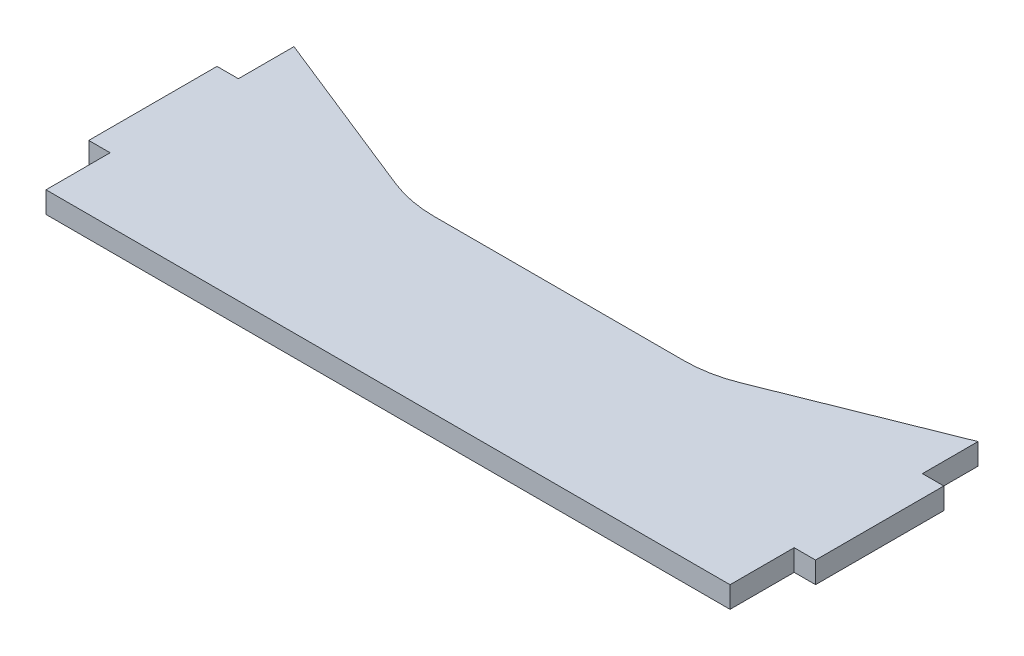
from build123d import *

# Parameters (mm, degrees)
SKETCH_1_W          = 170
SKETCH_1_H          = 40
EXTRUDE_1_DEPTH     = 5
EXTRUDE_2_DEPTH     = 5
FILLET_1_R          = 30
SKETCH_3_W          = 5
SKETCH_3_H          = 15
CUT_EXTRUDE_1_DEPTH = 10


with BuildPart() as part:
    # 스케치1 → 보스-돌출1 (new body)
    with BuildSketch(Plane(origin=(0, 0, 0), x_dir=(1, 0, 0), z_dir=(0, 1, 0))):
        with Locations((85, 20)):
            Rectangle(SKETCH_1_W, SKETCH_1_H)
    extrude(amount=EXTRUDE_1_DEPTH)

    # 스케치2 → 보스-돌출2 (add)
    with BuildSketch(Plane(origin=(0, 5, 0), x_dir=(1, 0, 0), z_dir=(0, 1, 0))):
        Polygon((170, 40), (170, 60), (120, 40), align=None)
        Polygon((0, 40), (0, 60), (50, 40), align=None)
    extrude(amount=-EXTRUDE_2_DEPTH)

    # 필렛1
    fillet_1_edges = [part.edges().sort_by_distance(p)[0] for p in [
        (120, 2.5, -40),
        (50, 2.5, -40),
    ]]
    fillet(fillet_1_edges, radius=FILLET_1_R)

    # 스케치3 → 컷-돌출1 (cut)
    with BuildSketch(Plane(origin=(0, 0, 0), x_dir=(-1, 0, 0), z_dir=(0, -1, 0))):
        with Locations((-2.5, 52.5)):
            Rectangle(SKETCH_3_W, SKETCH_3_H)
        with Locations((-2.5, 7.5)):
            Rectangle(SKETCH_3_W, SKETCH_3_H)
        with Locations((-167.5, 52.5)):
            Rectangle(SKETCH_3_W, SKETCH_3_H)
        with Locations((-167.5, 7.5)):
            Rectangle(SKETCH_3_W, SKETCH_3_H)
    extrude(amount=-CUT_EXTRUDE_1_DEPTH, mode=Mode.SUBTRACT)


solid = part.part
